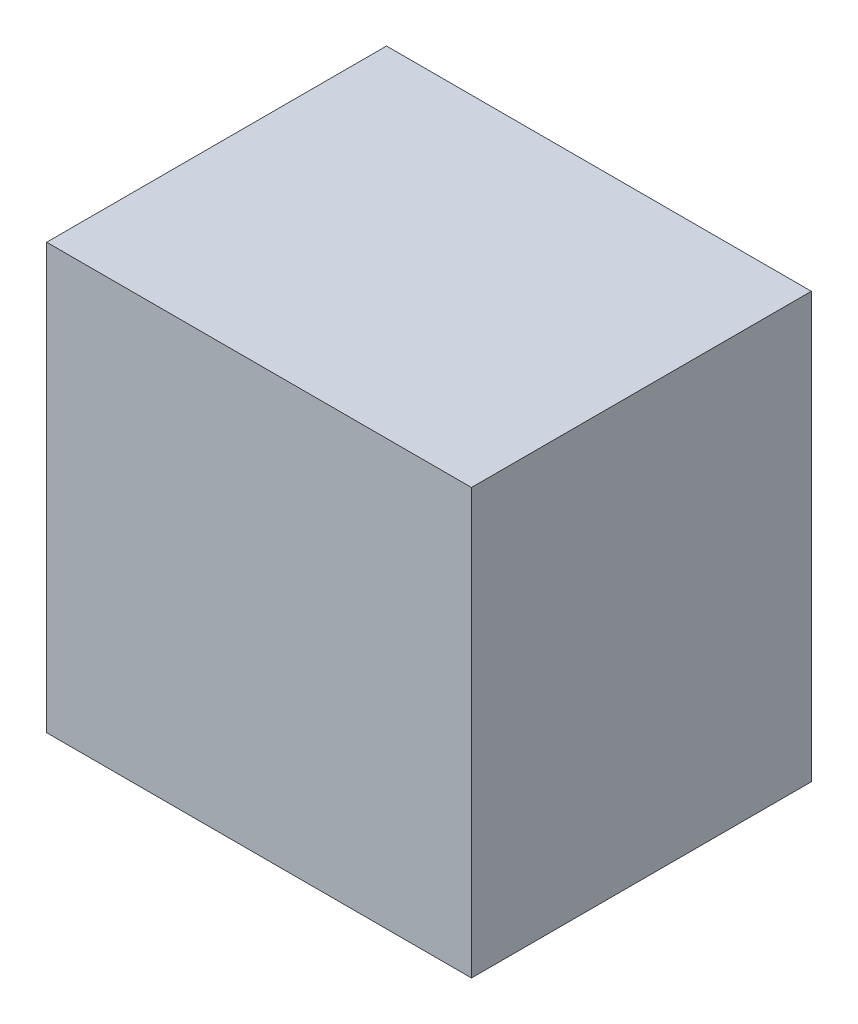
from build123d import *

# Parameters (mm, degrees)
SKETCH1_W           = 25
SKETCH1_H           = 25
BOSS_EXTRUDE1_DEPTH = 20


with BuildPart() as part:
    # Sketch1 → Boss-Extrude1 (new body)
    with BuildSketch(Plane.XY):
        Rectangle(SKETCH1_W, SKETCH1_H)
    extrude(amount=BOSS_EXTRUDE1_DEPTH)


solid = part.part
